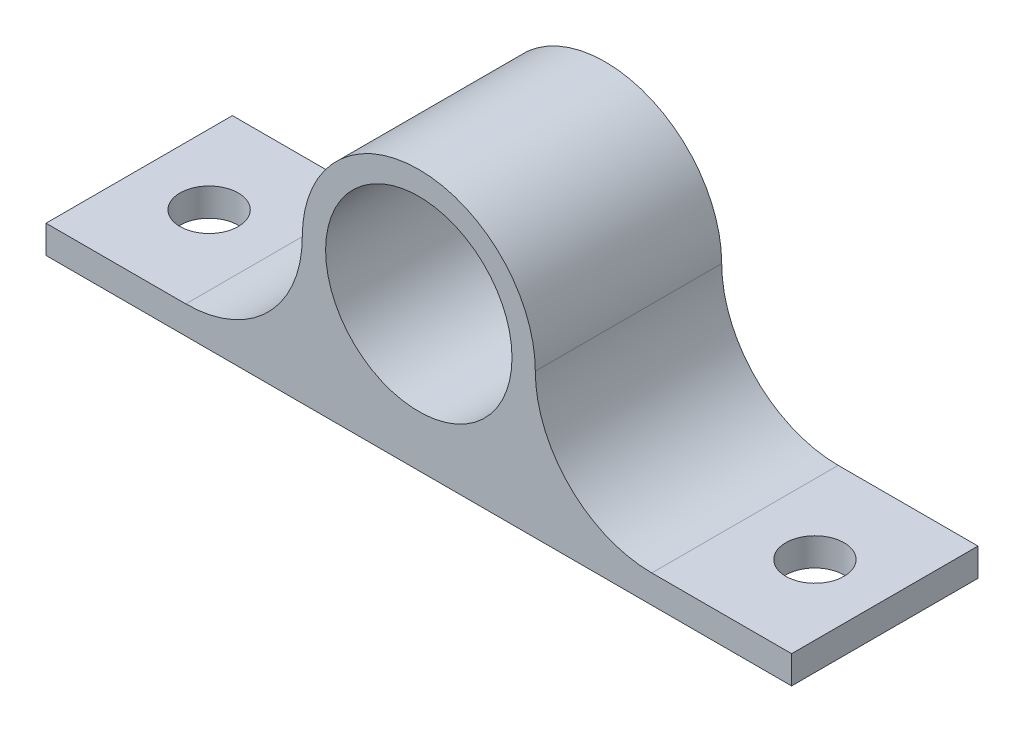
from build123d import *

# Parameters (mm, degrees)
SKETCH1_R                      = 15.875
SKETCH1_R_2                    = 12.7
SKETCH1_W                      = 101.6
SKETCH1_H                      = 3.81
BOSS_EXTRUDE1_DEPTH            = 25.4
F_5_16_0_3125_DIAMETER_HOLE1_D = 7.9375


with BuildPart() as part:
    # Sketch1 → Boss-Extrude1 (new body)
    # profile 1 of 4: a face of its own
    with BuildSketch(Plane.XY):
        Circle(SKETCH1_R)
        Circle(SKETCH1_R_2, mode=Mode.SUBTRACT)
    # profile 2 of 4: a face of its own
    with BuildSketch(Plane.XY):
        with BuildLine():
            ThreePointArc((-15.875, 0), (-20.524679849, -11.225320151), (-31.75, -15.875))
            Line((-31.75, -15.875), (3.4e-08, -15.875))
            ThreePointArc((3.4e-08, -15.875), (-11.225320139, -11.225320163), (-15.875, 0))
        make_face()
    # profile 3 of 4: a face of its own
    with BuildSketch(Plane.XY):
        with BuildLine():
            ThreePointArc((15.875, 0), (11.225320163, -11.225320139), (3.4e-08, -15.875))
            Line((3.4e-08, -15.875), (31.75, -15.875))
            ThreePointArc((31.75, -15.875), (20.524679849, -11.225320151), (15.875, 0))
        make_face()
    # profile 4 of 4: a face of its own
    with BuildSketch(Plane.XY):
        with Locations((0, -17.78)):
            Rectangle(SKETCH1_W, SKETCH1_H)
    extrude(amount=BOSS_EXTRUDE1_DEPTH)

    # 5/16 (0.3125) Diameter Hole1 (through all)
    with Locations(Plane(origin=(-41.275, -15.875, 12.7), x_dir=(1, 0, 0), z_dir=(0, 1, 0))):
        with Locations((0, 0)):
            f_5_16_0_3125_diameter_hole1 = Hole(F_5_16_0_3125_DIAMETER_HOLE1_D / 2)

    # Mirror1: 5/16 (0.3125) Diameter Hole1 across plane
    add(f_5_16_0_3125_diameter_hole1.mirror(Plane(origin=(0, 0, 0), x_dir=(0, 0, 1), z_dir=(1, 0, 0))), mode=Mode.SUBTRACT)


solid = part.part
